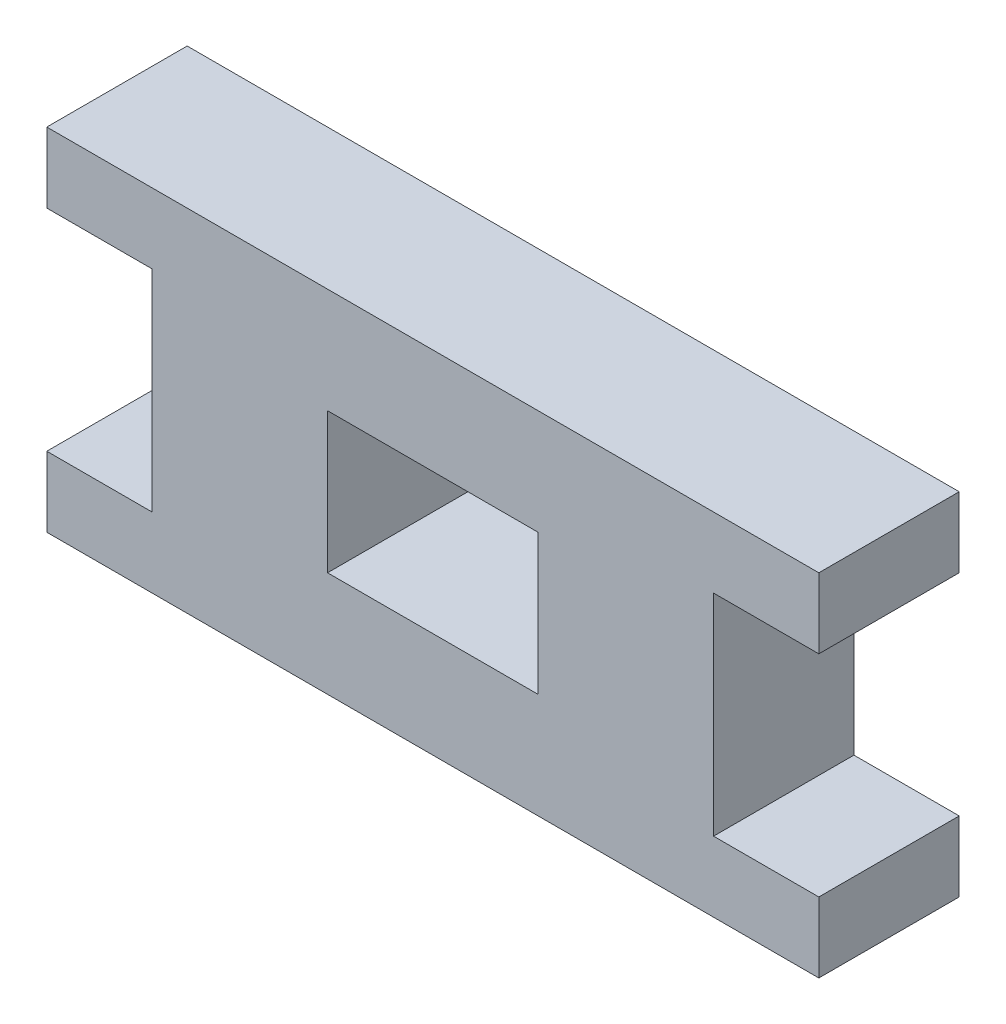
from build123d import *

# Parameters (mm, degrees)
SKETCH1_W           = 30
SKETCH1_H           = 20
BOSS_EXTRUDE1_DEPTH = 20


with BuildPart() as part:
    # Sketch1 → Boss-Extrude1 (new body)
    with BuildSketch(Plane.XY):
        Polygon((-40, -25), (40, -25), (55, -25), (55, -15), (40, -15), (40, 15), (55, 15), (55, 25), (40, 25), (-40, 25), (-55, 25), (-55, 15), (-40, 15), (-40, -15), (-55, -15), (-55, -25), align=None)
        Rectangle(SKETCH1_W, SKETCH1_H, mode=Mode.SUBTRACT)
    extrude(amount=BOSS_EXTRUDE1_DEPTH)


solid = part.part
